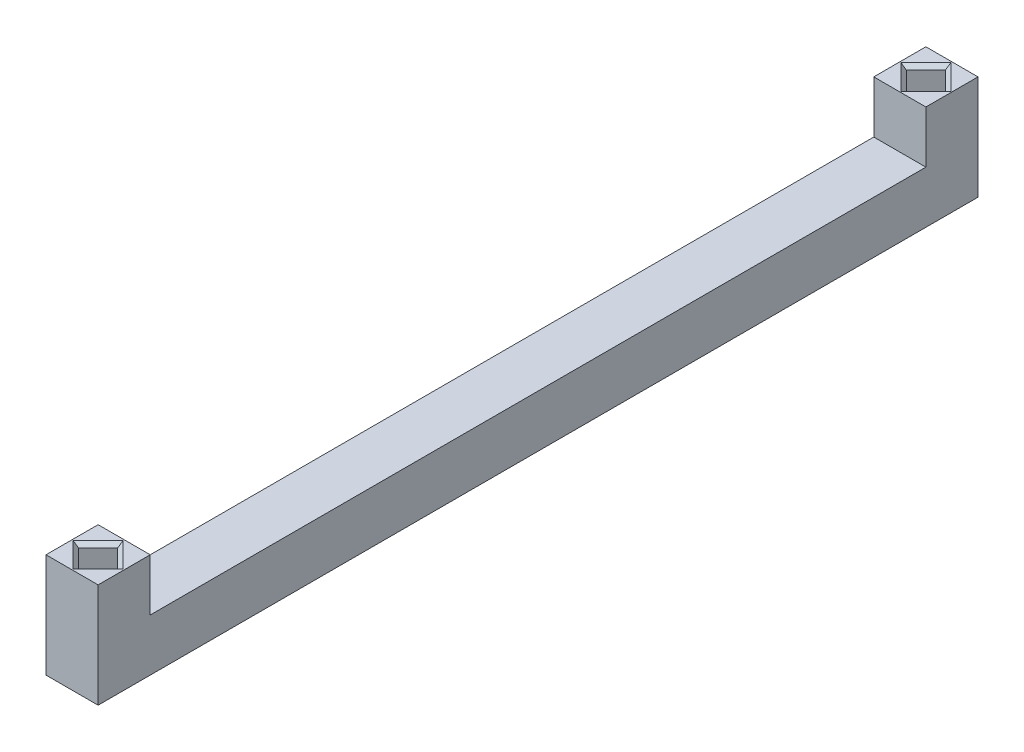
from build123d import *

# Parameters (mm, degrees)
BOSS_EXTRUDE1_DEPTH = 8.466666667
CUT_EXTRUDE1_DEPTH  = 5.08
CHAMFER1_SIZE       = 0.635


with BuildPart() as part:
    # Sketch1 → Boss-Extrude1 (new body)
    with BuildSketch(Plane(origin=(0, 0, 0), x_dir=(0, 0, -1), z_dir=(1, 0, 0))):
        Polygon((-71.466673, 8.466666667), (-71.466673, -8.466666667), (71.466673, -8.466666667), (71.466673, 8.466666667), (63.000006333, 8.466666667), (63.000006333, 0), (-63.000006333, 0), (-63.000006333, 8.466666667), align=None)
    extrude(amount=BOSS_EXTRUDE1_DEPTH)

    # Sketch2 → Cut-Extrude1 (cut)
    with BuildSketch(Plane(origin=(0, 8.466666667, 0), x_dir=(1, 0, 0), z_dir=(0, 1, 0))):
        Polygon((1.058333333, -67.233339667), (4.233333333, -64.058339667), (7.408333333, -67.233339667), (4.233333333, -70.408339667), align=None)
        Polygon((1.058333333, 67.233339667), (4.233333333, 70.408339667), (7.408333333, 67.233339667), (4.233333333, 64.058339667), align=None)
    extrude(amount=-CUT_EXTRUDE1_DEPTH, mode=Mode.SUBTRACT)

    # Chamfer1
    chamfer1_edges = [part.edges().sort_by_distance(p)[0] for p in [
        (2.645833333, 3.386666667, 68.820839667),
        (2.645833333, 3.386666667, 65.645839667),
        (5.820833333, 3.386666667, 65.645839667),
        (5.820833333, 3.386666667, 68.820839667),
        (2.645833333, 8.466666667, 68.820839667),
        (5.820833333, 8.466666667, 68.820839667),
        (5.820833333, 8.466666667, 65.645839667),
        (2.645833333, 8.466666667, 65.645839667),
        (2.645833333, 3.386666667, -65.645839667),
        (2.645833333, 3.386666667, -68.820839667),
        (5.820833333, 3.386666667, -68.820839667),
        (5.820833333, 3.386666667, -65.645839667),
        (2.645833333, 8.466666667, -65.645839667),
        (5.820833333, 8.466666667, -65.645839667),
        (5.820833333, 8.466666667, -68.820839667),
        (2.645833333, 8.466666667, -68.820839667),
    ]]
    chamfer(chamfer1_edges, length=CHAMFER1_SIZE)


solid = part.part
